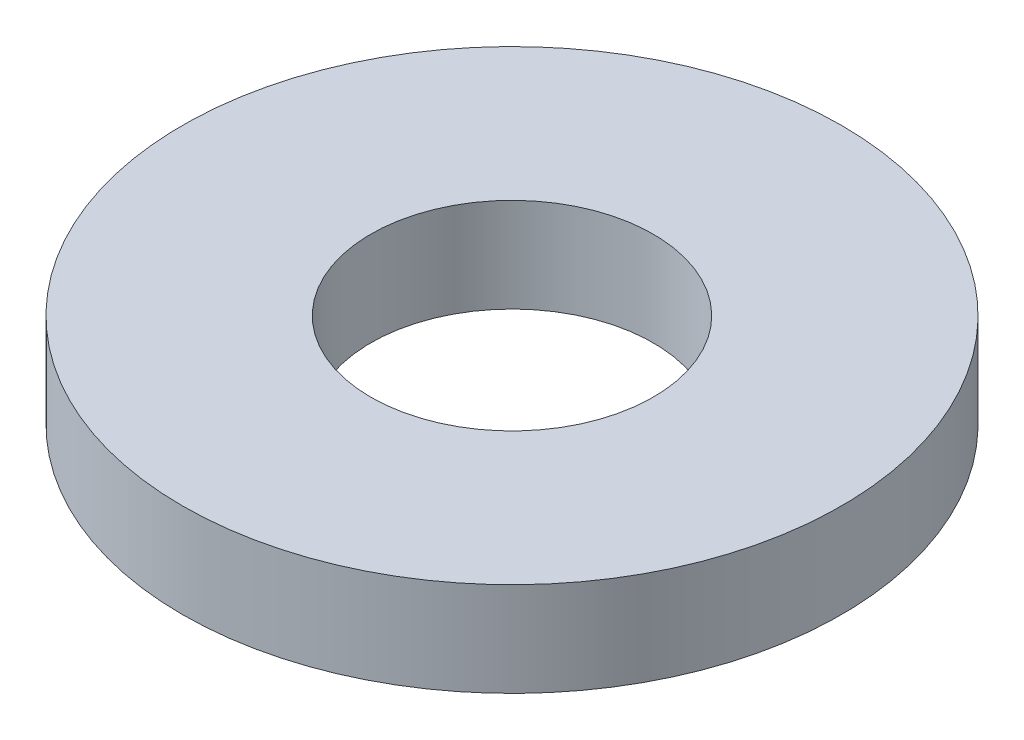
from build123d import *

# Parameters (mm, degrees)
SKETCH_1_R      = 3.5
SKETCH_1_R_2    = 1.5
EXTRUDE_1_DEPTH = 1


with BuildPart() as part:
    # 草图1 → 凸台-拉伸1 (new body)
    with BuildSketch(Plane(origin=(0, 0, 0), x_dir=(1, 0, 0), z_dir=(0, 1, 0))):
        with Locations(Location((0, 0, 0), (0, 0, 270))):
            Circle(SKETCH_1_R)
        with Locations(Location((0, 0, 0), (0, 0, 270))):
            Circle(SKETCH_1_R_2, mode=Mode.SUBTRACT)
    extrude(amount=EXTRUDE_1_DEPTH)


solid = part.part
